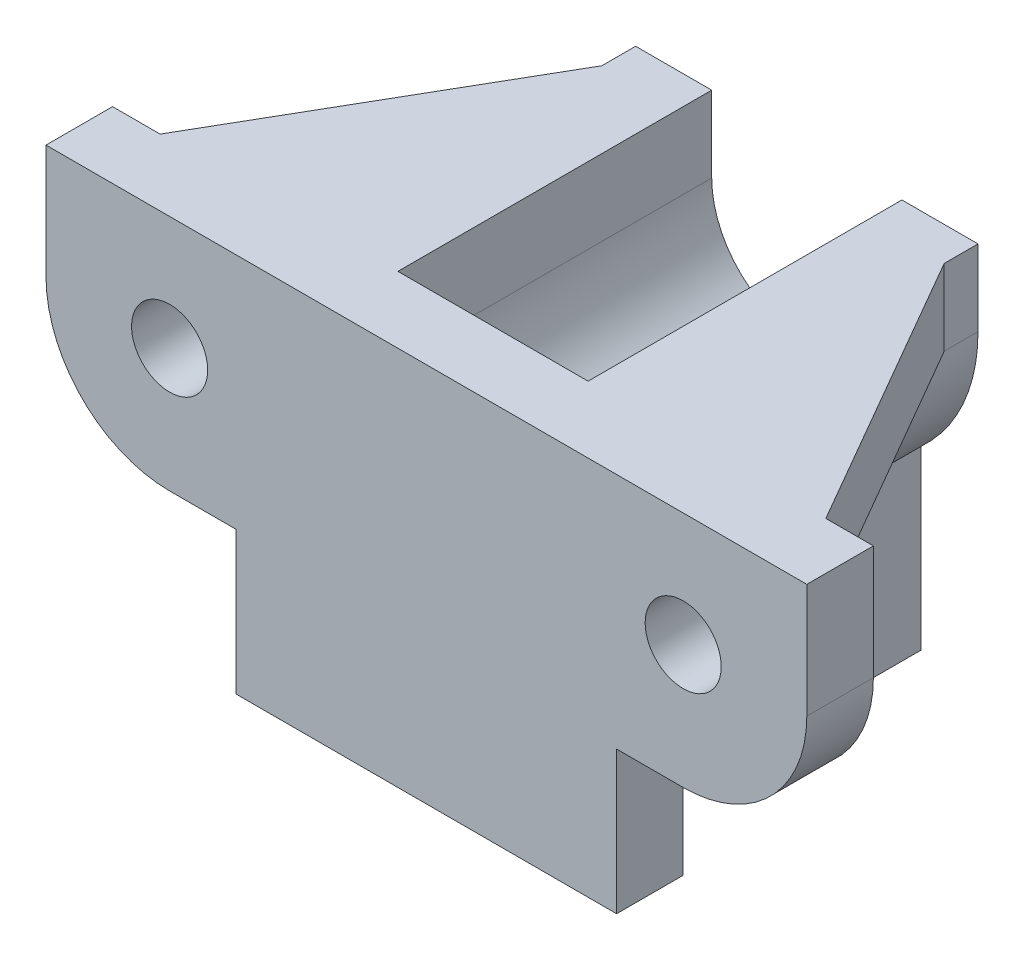
from build123d import *

# Parameters (mm, degrees)
SKETCH_1_R           = 4
EXTRUDE_1_DEPTH      = 7
EXTRUDE_2_DEPTH      = 33
EXTRUDE_3_DEPTH      = 8
EXTRUDE_4_REACH      = 71.282
EXTRUDE_4_END_RADIUS = 18
CUT_EXTRUDE_1_DEPTH  = 70.28203236


with BuildPart() as part:
    # 草图1 → 凸台-拉伸1 (new body)
    with BuildSketch(Plane.XY):
        with BuildLine():
            Line((-40, 0), (40, 0))
            Line((40, 0), (40, -12))
            ThreePointArc((40, -12), (36.192388155, -21.192388155), (27, -25))
            Line((27, -25), (20, -25))
            Line((20, -25), (20, -40))
            Line((20, -40), (-20, -40))
            Line((-20, -40), (-20, -25))
            Line((-20, -25), (-27, -25))
            ThreePointArc((-27, -25), (-36.192388155, -21.192388155), (-40, -12))
            Line((-40, -12), (-40, 0))
        make_face()
        with Locations((-27, -12)):
            Circle(SKETCH_1_R, mode=Mode.SUBTRACT)
        with Locations(Location((27, -12, 0), (0, 0, 180))):
            Circle(SKETCH_1_R, mode=Mode.SUBTRACT)
    extrude(amount=-EXTRUDE_1_DEPTH)

    # 草图2 → 凸台-拉伸2 (add)
    with BuildSketch(Plane(origin=(0, 0, -7), x_dir=(-1, 0, 0), z_dir=(0, 0, -1))):
        with BuildLine():
            Line((-10, 0), (-10, -8))
            ThreePointArc((-10, -8), (0, -18), (10, -8))
            Line((10, -8), (10, 0))
            Line((10, 0), (18, 0))
            Line((18, 0), (18, -8))
            ThreePointArc((18, -8), (0, -26), (-18, -8))
            Line((-18, -8), (-18, 0))
            Line((-18, 0), (-10, 0))
        make_face()
    extrude(amount=EXTRUDE_2_DEPTH)

    # 草图3 → 凸台-拉伸3 (add)
    with BuildSketch(Plane(origin=(0, 0, 0), x_dir=(1, 0, 0), z_dir=(0, 1, 0))):
        Polygon((18, 36.444863729), (35, 7), (18, 7), align=None)
        Polygon((-18, 36.444863729), (-35, 7), (-18, 7), align=None)
    extrude(amount=-EXTRUDE_3_DEPTH)

    # 凸台-拉伸4: up to this cylinder (the profile starts outside it)
    extrude_4_end = Plane(origin=(0, -8, -28.116235), z_dir=(0, 0, 1)) * Cylinder(EXTRUDE_4_END_RADIUS, 179.564, mode=Mode.PRIVATE)
    # 草图4 → 凸台-拉伸4 (add, up to the surface)
    with BuildSketch(Plane.XZ.offset(40), mode=Mode.PRIVATE) as extrude_4_sk1:
        with BuildLine():
            Line((12, -40), (12, -31))
            ThreePointArc((12, -31), (9.486832981, -23.651530772), (3, -19.381049961))
            Line((3, -19.381049961), (3, -7))
            Line((3, -7), (-3, -7))
            Line((-3, -7), (-3, -19.381049961))
            ThreePointArc((-3, -19.381049961), (-9.486832981, -23.651530772), (-12, -31))
            Line((-12, -31), (-12, -40))
            Line((-12, -40), (12, -40))
        make_face()
    extrude_4_tool1 = extrude(extrude_4_sk1.sketch, amount=-EXTRUDE_4_REACH, mode=Mode.PRIVATE) - extrude_4_end
    add(extrude_4_tool1.solids().sort_by_distance((0, -40, -28.116235))[0])

    # 草图5 → 切除-拉伸1 (cut, through all)
    with BuildSketch(Plane.XZ.offset(40)):
        with BuildLine():
            Line((6, -40), (6, -31))
            ThreePointArc((6, -31), (0, -25), (-6, -31))
            Line((-6, -31), (-6, -40))
            Line((-6, -40), (6, -40))
        make_face()
    extrude(amount=-CUT_EXTRUDE_1_DEPTH, mode=Mode.SUBTRACT)


solid = part.part
